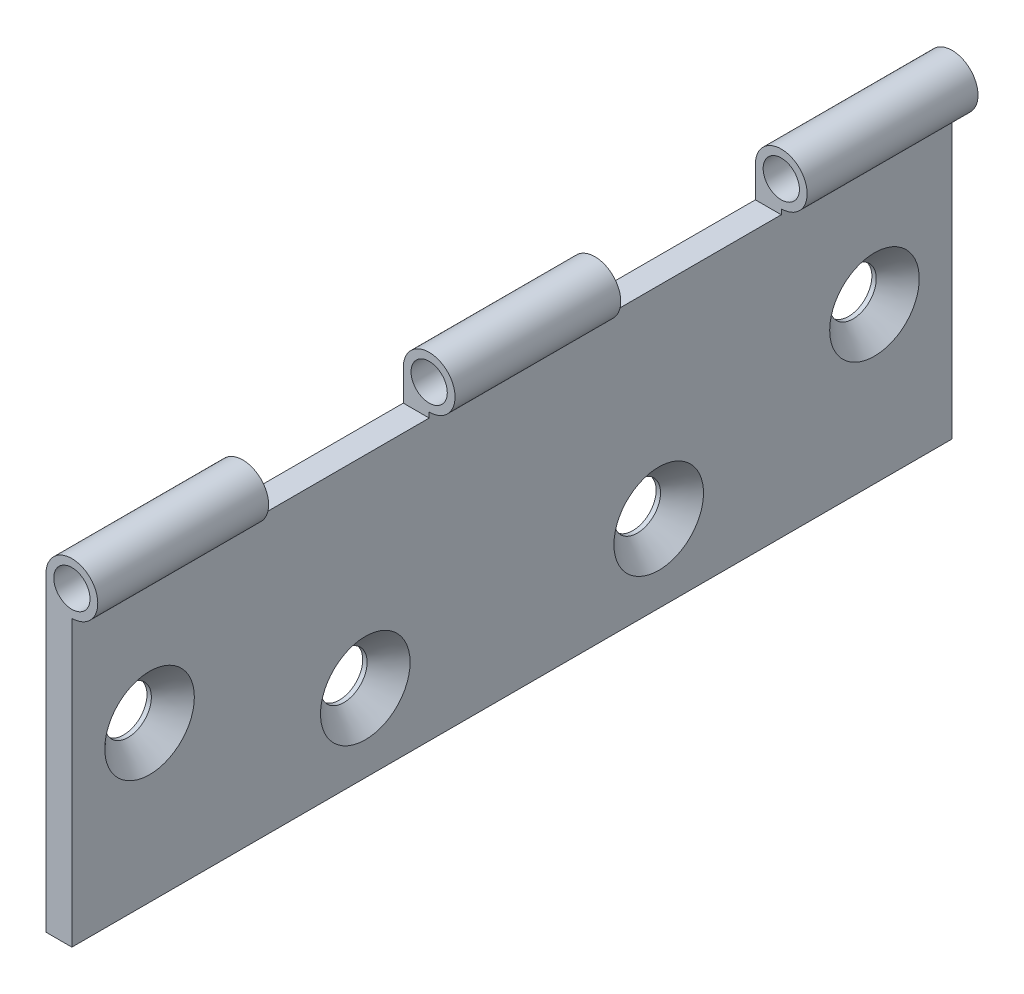
from build123d import *

# Parameters (mm, degrees)
SKETCH1_W                                      = 5
SKETCH1_H                                      = 60
EXTRUDE_THIN1_DEPTH                            = 85
SKETCH3_R                                      = 5
SKETCH4_R                                      = 3.5
CUT_EXTRUDE1_DEPTH                             = 183.277261336
CSK_FOR_M8_FLAT_HEAD_MACHINE_SCREW1_AT_2_COUNT = 2
CSK_FOR_M8_FLAT_HEAD_MACHINE_SCREW1_AT_2_PITCH = 44.284434185
F_2CUTS_DEPTH                                  = 108.121426428
F_2CUTS_DEPTH_BACK                             = 108.121426428
SKETCH9_W                                      = 36
SKETCH9_H                                      = 11


with BuildPart() as part:
    # Sketch1 → Extrude-Thin1 (new, symmetric)
    with BuildSketch(Plane.XY):
        with Locations((2.5, 30)):
            Rectangle(SKETCH1_W, SKETCH1_H)
    extrude(amount=EXTRUDE_THIN1_DEPTH, both=True)

    # Sweep1: sweep along a curve in space
    with BuildLine() as sweep1_path:
        Line((5, 60, 85), (5, 60, -85))
    # Sketch3 → Sweep1 (sweep)
    with BuildSketch(Plane.XY.offset(85)):
        with Locations((5, 60)):
            Circle(SKETCH3_R)
    sweep(path=sweep1_path.line)

    # Sketch4 → Cut-Extrude1 (cut, through all)
    with BuildSketch(Plane.XY.offset(85)):
        with Locations((5, 60)):
            Circle(SKETCH4_R)
    extrude(amount=-CUT_EXTRUDE1_DEPTH, mode=Mode.SUBTRACT)

    # Sketch5 → CSK for M8 Flat Head Machine Screw1 (revolve, cut)
    with BuildSketch(Plane(origin=(5, 30, 70), x_dir=(0, 0, -1), z_dir=(0, 1, 0))):
        Polygon((0, 0), (0, 5), (4.5, 5), (4.5, 4.15), (8.65, 0), align=None)
    csk_for_m8_flat_head_machine_screw1 = revolve(axis=Axis((11.35, 30, 70), (-1, 0, 0)), mode=Mode.SUBTRACT)

    # CSK for M8 Flat Head Machine Screw1 at 2: CSK for M8 Flat Head Machine Screw1 ×2
    with Locations(*[Vector(0, -0.33871946827274174, -0.9408874118687268) * (i * CSK_FOR_M8_FLAT_HEAD_MACHINE_SCREW1_AT_2_PITCH) for i in range(1, CSK_FOR_M8_FLAT_HEAD_MACHINE_SCREW1_AT_2_COUNT)]):
        add(csk_for_m8_flat_head_machine_screw1, mode=Mode.SUBTRACT)

    # Mirror1: CSK for M8 Flat Head Machine Screw1 across plane
    add(csk_for_m8_flat_head_machine_screw1.mirror(Plane.XY), mode=Mode.SUBTRACT)

    # Mirror1 copy 1 sketch → Mirror1 copy 1 (revolve, cut)
    with BuildSketch(Plane(origin=(5, 15, -28.333333333), x_dir=(0, 0, 1), z_dir=(0, 1, 0))):
        Polygon((0, 0), (0, -5), (4.5, -5), (4.5, -4.15), (8.65, 0), align=None)
    revolve(axis=Axis((11.35, 15, -28.333333333), (1, 0, 0)), mode=Mode.SUBTRACT)

    # Sketch9 → 2Cuts (cut, two sides: drawn at the far end of the back side and taken through both)
    with BuildSketch(Plane(origin=(5, 0, 0), x_dir=(0, 0, -1), z_dir=(1, 0, 0)).offset(-F_2CUTS_DEPTH_BACK)):
        with Locations((34, 59.5)):
            Rectangle(SKETCH9_W, SKETCH9_H)
        with Locations((-34, 59.5)):
            Rectangle(SKETCH9_W, SKETCH9_H)
    extrude(amount=F_2CUTS_DEPTH + F_2CUTS_DEPTH_BACK, mode=Mode.SUBTRACT)


solid = part.part
